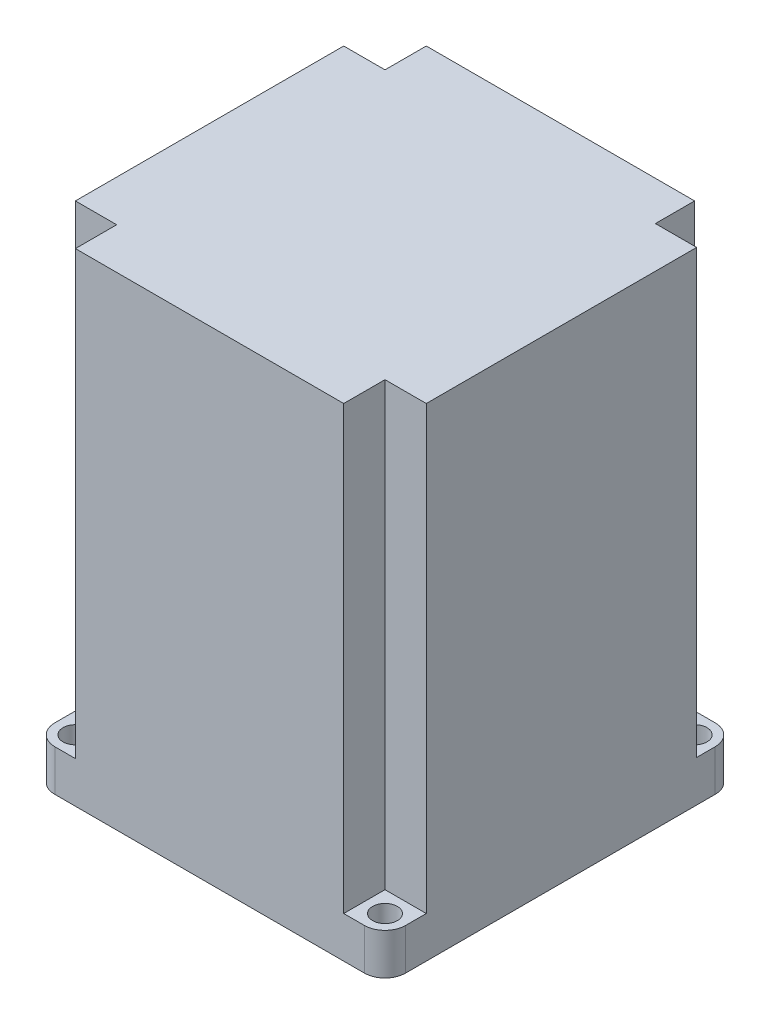
from build123d import *

# Parameters (mm, degrees)
CROQUIS1_W              = 85
CROQUIS1_H              = 85
SALIENTE_EXTRUIR1_DEPTH = 117
CORTAR_EXTRUIR1_START   = 10
CROQUIS2_W              = 10
CROQUIS2_H              = 10
CROQUIS2_H_2            = 9.5
CORTAR_EXTRUIR1_DEPTH   = 117
CROQUIS3_R              = 31
CORTAR_EXTRUIR2_DEPTH   = 2
CROQUIS4_R              = 8
SALIENTE_EXTRUIR2_DEPTH = 36
CROQUIS7_R              = 3
CORTAR_EXTRUIR3_DEPTH   = 10
REDONDEO7_R             = 5


with BuildPart() as part:
    # Croquis1 → Saliente-Extruir1 (new body)
    with BuildSketch(Plane(origin=(0, 0, 0), x_dir=(1, 0, 0), z_dir=(0, 1, 0))):
        Rectangle(CROQUIS1_W, CROQUIS1_H)
    extrude(amount=SALIENTE_EXTRUIR1_DEPTH)

    # Croquis2 → Cortar-Extruir1 (cut)
    with BuildSketch(Plane(origin=(0, 117, 0), x_dir=(1, 0, 0), z_dir=(0, 1, 0)).offset(CORTAR_EXTRUIR1_START)):
        with Locations((-37.5, 37.5)):
            Rectangle(CROQUIS2_W, CROQUIS2_H)
        with Locations((37.5, 37.75)):
            Rectangle(CROQUIS2_W, CROQUIS2_H_2)
        with Locations((-37.5, -37.5)):
            Rectangle(CROQUIS2_W, CROQUIS2_H)
        with Locations((37.5, -37.5)):
            Rectangle(CROQUIS2_W, CROQUIS2_H)
    extrude(amount=-CORTAR_EXTRUIR1_DEPTH, mode=Mode.SUBTRACT)

    # Croquis3 → Cortar-Extruir2 (cut)
    with BuildSketch(Plane.XZ):
        with Locations(Location((0, 0, 0), (0, 0, 270))):
            Circle(CROQUIS3_R)
    extrude(amount=-CORTAR_EXTRUIR2_DEPTH, mode=Mode.SUBTRACT)

    # Croquis4 → Saliente-Extruir2 (add)
    with BuildSketch(Plane.XZ.offset(-2)):
        with Locations(Location((0, 0, 0), (0, 0, 270))):
            Circle(CROQUIS4_R)
    extrude(amount=SALIENTE_EXTRUIR2_DEPTH)

    # Croquis7 → Cortar-Extruir3 (cut)
    with BuildSketch(Plane.XZ):
        with Locations(Location((37.5, -37.5, 0), (0, 0, 270))):
            Circle(CROQUIS7_R)
        with Locations(Location((-37.5, -37.5, 0), (0, 0, 270))):
            Circle(CROQUIS7_R)
        with Locations(Location((-37.5, 37.5, 0), (0, 0, 270))):
            Circle(CROQUIS7_R)
        with Locations(Location((37.5, 37.5, 0), (0, 0, 270))):
            Circle(CROQUIS7_R)
    extrude(amount=-CORTAR_EXTRUIR3_DEPTH, mode=Mode.SUBTRACT)

    # Redondeo7
    redondeo7_edges = [part.edges().sort_by_distance(p)[0] for p in [
        (42.5, 5, 42.5),
        (-42.5, 5, 42.5),
        (-42.5, 5, -42.5),
        (42.5, 5, -42.5),
    ]]
    fillet(redondeo7_edges, radius=REDONDEO7_R)


solid = part.part
